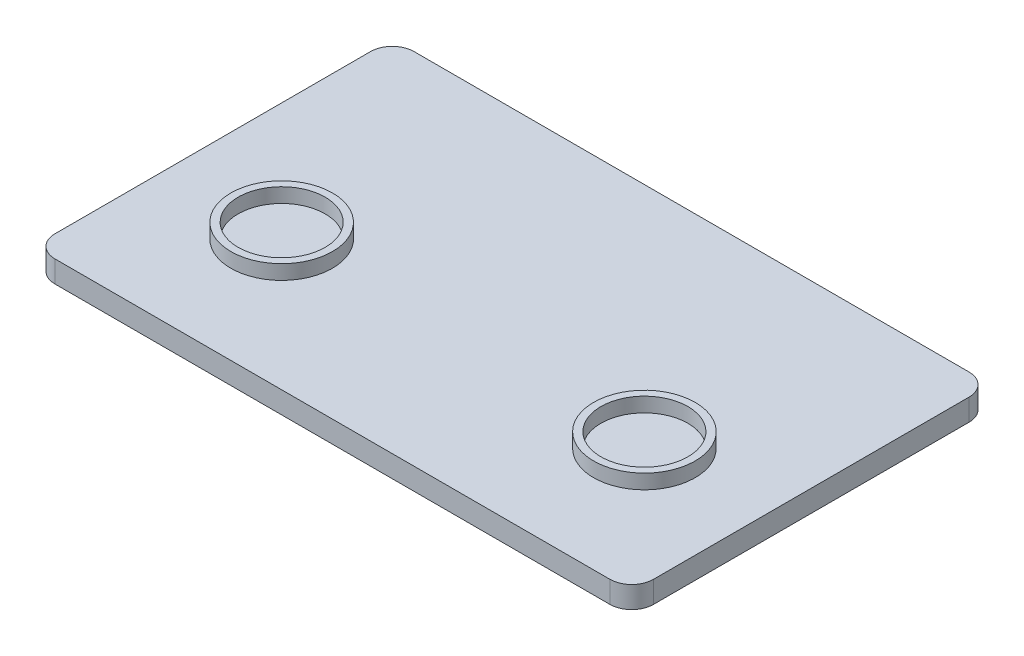
from build123d import *

# Parameters (mm, degrees)
BOSS_EXTRUDE1_DEPTH = 3
SKETCH2_R           = 7
SKETCH2_R_2         = 6
BOSS_EXTRUDE2_DEPTH = 2


with BuildPart() as part:
    # Sketch1 → Boss-Extrude1 (new body)
    with BuildSketch(Plane(origin=(0, 0, 0), x_dir=(1, 0, 0), z_dir=(0, 1, 0))):
        with BuildLine():
            Line((-38.25, 24.75), (38.25, 24.75))
            ThreePointArc((38.25, 24.75), (40.371320344, 23.871320344), (41.25, 21.75))
            Line((41.25, 21.75), (41.25, -21.75))
            ThreePointArc((41.25, -21.75), (40.371320344, -23.871320344), (38.25, -24.75))
            Line((38.25, -24.75), (-38.25, -24.75))
            ThreePointArc((-38.25, -24.75), (-40.371320344, -23.871320344), (-41.25, -21.75))
            Line((-41.25, -21.75), (-41.25, 21.75))
            ThreePointArc((-41.25, 21.75), (-40.371320344, 23.871320344), (-38.25, 24.75))
        make_face()
    extrude(amount=BOSS_EXTRUDE1_DEPTH)

    # Sketch2 → Boss-Extrude2 (add)
    # profile 1 of 2: a face of its own
    with BuildSketch(Plane(origin=(0, 3, 0), x_dir=(1, 0, 0), z_dir=(0, 1, 0))):
        with Locations(Location((-25, -6.75, 0), (0, 0, 90))):
            Circle(SKETCH2_R)
        with Locations(Location((-25, -6.75, 0), (0, 0, 270))):
            Circle(SKETCH2_R_2, mode=Mode.SUBTRACT)
    # profile 2 of 2: a face of its own
    with BuildSketch(Plane(origin=(0, 3, 0), x_dir=(1, 0, 0), z_dir=(0, 1, 0))):
        with Locations(Location((25, -6.75, 0), (0, 0, 90))):
            Circle(SKETCH2_R)
        with Locations(Location((25, -6.75, 0), (0, 0, 90))):
            Circle(SKETCH2_R_2, mode=Mode.SUBTRACT)
    extrude(amount=BOSS_EXTRUDE2_DEPTH)


solid = part.part
